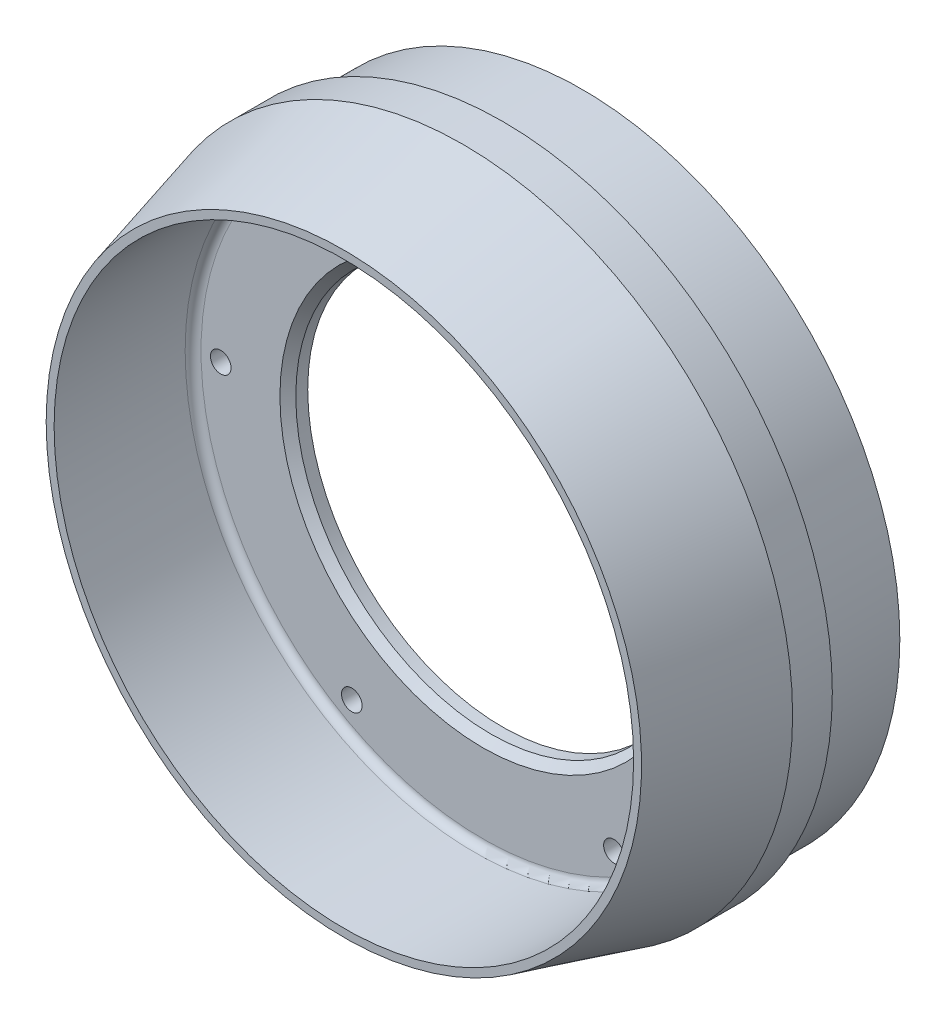
from build123d import *

# Parameters (mm, degrees)
CHAMFER1_SIZE              = 2
CHAMFER2_SIZE              = 2
F_6_0_204_DIAMETER_HOLE1_D = 5.1816
CIRPATTERN1_COUNT          = 6
FILLET2_R                  = 5
FILLET3_R                  = 2


with BuildPart() as part:
    # Sketch2 → Revolve1 (revolve)
    with BuildSketch(Plane(origin=(0, 0, 0), x_dir=(0, 0, -1), z_dir=(1, 0, 0)), mode=Mode.PRIVATE) as revolve1_sk:
        Polygon((-5, 83), (-35, 74.961524227), (-35, 72.961524227), (0, 72.961524227), (0, 49.1), (5, 49.1), (5, 77.5), (25, 77.5), (25, 80), (5, 80), (5, 83), align=None)
    revolve(revolve1_sk.sketch.rotate(Axis((0, 0, -77), (0, 0, 1)), 90), axis=Axis((0, 0, -77), (0, 0, 1)))

    # Chamfer1
    chamfer1_edges = [part.edges().sort_by_distance(p)[0] for p in [
        (77.5, 0, -25),
    ]]
    chamfer(chamfer1_edges, length=CHAMFER1_SIZE)

    # Chamfer2
    chamfer2_edges = [part.edges().sort_by_distance(p)[0] for p in [
        (49.1, 0, 0),
    ]]
    chamfer(chamfer2_edges, length=CHAMFER2_SIZE)

    # #6 (0.204) Diameter Hole1 (through all)
    with Locations(Plane.XY):
        with Locations((-33, 57.15767665)):
            f_6_0_204_diameter_hole1 = Hole(F_6_0_204_DIAMETER_HOLE1_D / 2)

    # CirPattern1: #6 (0.204) Diameter Hole1 ×6 about axis
    cirpattern1_axis = Axis((0, 0, 0), (0, 0, 1))
    for i in range(1, CIRPATTERN1_COUNT):
        add(f_6_0_204_diameter_hole1.rotate(cirpattern1_axis, i * 360 / CIRPATTERN1_COUNT), mode=Mode.SUBTRACT)

    # Fillet2
    fillet2_edges = [part.edges().sort_by_distance(p)[0] for p in [
        (77.5, 0, -5),
    ]]
    fillet(fillet2_edges, radius=FILLET2_R)

    # Fillet3
    fillet3_edges = [part.edges().sort_by_distance(p)[0] for p in [
        (72.961524227, 0, 0),
    ]]
    fillet(fillet3_edges, radius=FILLET3_R)


solid = part.part
